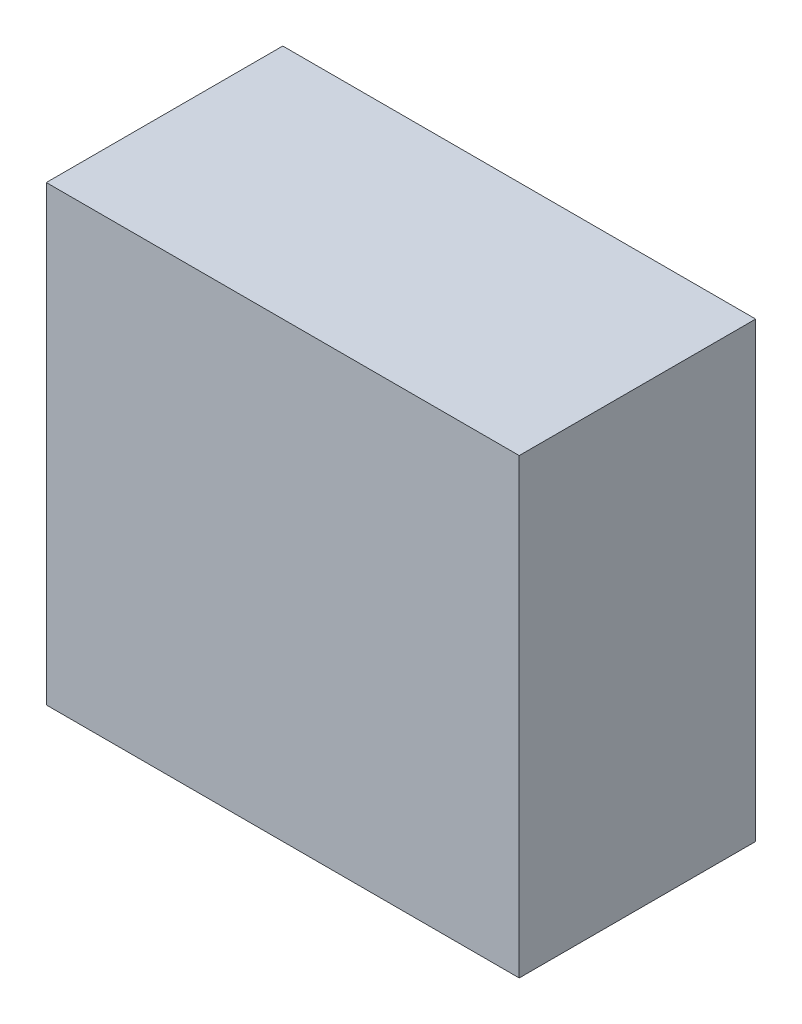
from build123d import *

# Parameters (mm, degrees)
SKETCH1_W           = 50.8
SKETCH1_H           = 48.602505196
BOSS_EXTRUDE1_DEPTH = 25.4


with BuildPart() as part:
    # Sketch1 → Boss-Extrude1 (new body)
    with BuildSketch(Plane.XY):
        Rectangle(SKETCH1_W, SKETCH1_H)
    extrude(amount=BOSS_EXTRUDE1_DEPTH)


solid = part.part
